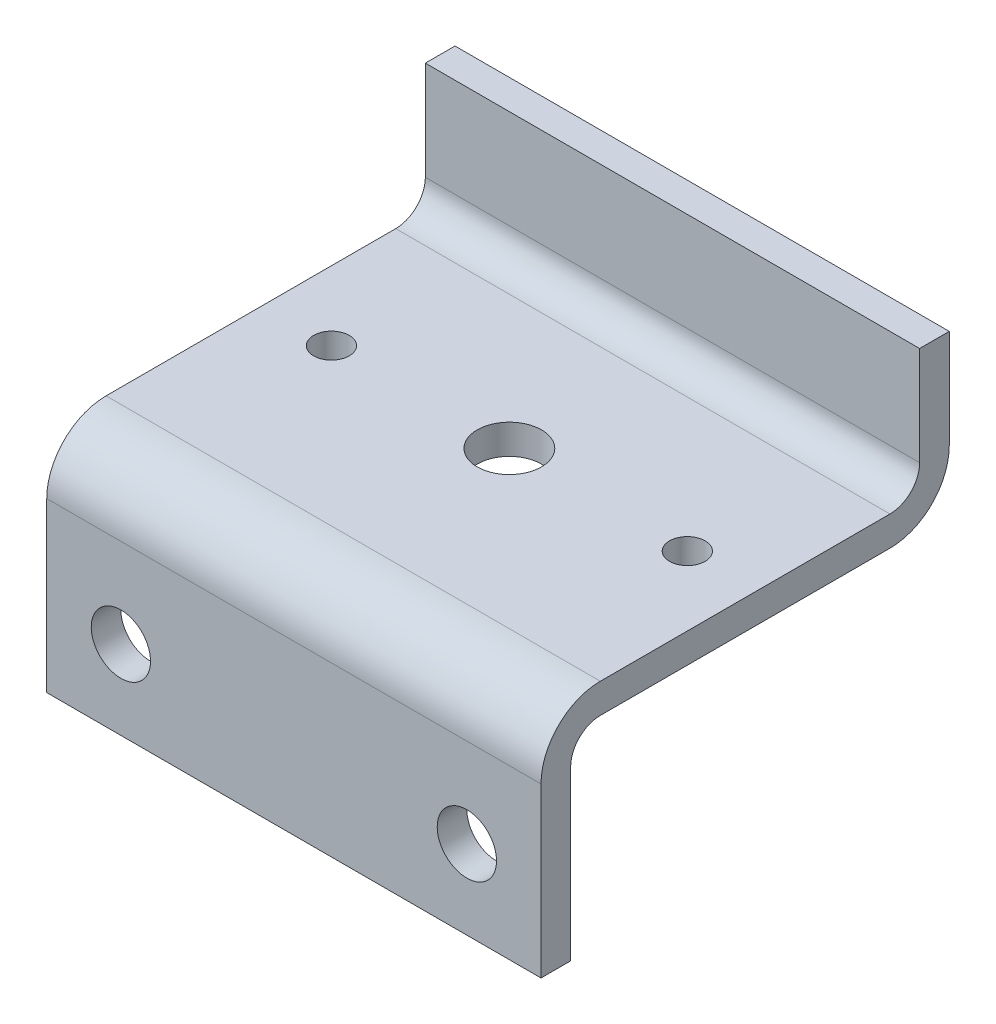
from build123d import *

# Parameters (mm, degrees)
BOSS_EXTRUDE1_DEPTH = 25
CUT_EXTRUDE1_REACH  = 55.476
SKETCH2_R           = 3.25
SKETCH2_R_2         = 1.8
CUT_EXTRUDE2_REACH  = 60.206
SKETCH3_R           = 3


with BuildPart() as part:
    # Sketch1 → Boss-Extrude1 (new, symmetric)
    with BuildSketch(Plane(origin=(0, 0, 0), x_dir=(0, 0, -1), z_dir=(1, 0, 0))):
        with BuildLine():
            Line((0, 0), (0, 17))
            ThreePointArc((0, 17), (1.757359313, 21.242640687), (6, 23))
            Line((6, 23), (35.3, 23))
            ThreePointArc((35.3, 23), (37.421320344, 23.878679656), (38.3, 26))
            Line((38.3, 26), (38.3, 36))
            Line((38.3, 36), (41.3, 36))
            Line((41.3, 36), (41.3, 26))
            ThreePointArc((41.3, 26), (39.542640687, 21.757359313), (35.3, 20))
            Line((35.3, 20), (6, 20))
            ThreePointArc((6, 20), (3.878679656, 19.121320344), (3, 17))
            Line((3, 17), (3, 0))
            Line((3, 0), (0, 0))
        make_face()
    extrude(amount=BOSS_EXTRUDE1_DEPTH, both=True)

    # Sketch2 → Cut-Extrude1 (cut, up to next)
    with BuildSketch(Plane(origin=(0, 23, 0), x_dir=(1, 0, 0), z_dir=(0, 1, 0)), mode=Mode.PRIVATE) as cut_extrude1_sk1:
        with Locations(Location((0, 21.8, 0), (0, 0, 270))):
            Circle(SKETCH2_R)
    cut_extrude1_tool1 = extrude(cut_extrude1_sk1.sketch, amount=-CUT_EXTRUDE1_REACH, mode=Mode.PRIVATE) & part.part
    # Sketch2 → Cut-Extrude1 (cut, up to next)
    with BuildSketch(Plane(origin=(0, 23, 0), x_dir=(1, 0, 0), z_dir=(0, 1, 0)), mode=Mode.PRIVATE) as cut_extrude1_sk2:
        with Locations(Location((-18, 21.8, 0), (0, 0, 270))):
            Circle(SKETCH2_R_2)
    cut_extrude1_tool2 = extrude(cut_extrude1_sk2.sketch, amount=-CUT_EXTRUDE1_REACH, mode=Mode.PRIVATE) & part.part
    # Sketch2 → Cut-Extrude1 (cut, up to next)
    with BuildSketch(Plane(origin=(0, 23, 0), x_dir=(1, 0, 0), z_dir=(0, 1, 0)), mode=Mode.PRIVATE) as cut_extrude1_sk3:
        with Locations(Location((18, 21.8, 0), (0, 0, 270))):
            Circle(SKETCH2_R_2)
    cut_extrude1_tool3 = extrude(cut_extrude1_sk3.sketch, amount=-CUT_EXTRUDE1_REACH, mode=Mode.PRIVATE) & part.part
    add(cut_extrude1_tool1.solids().sort_by_distance((0, 23, -21.8))[0], mode=Mode.SUBTRACT)
    add(cut_extrude1_tool2.solids().sort_by_distance((-18, 23, -21.8))[0], mode=Mode.SUBTRACT)
    add(cut_extrude1_tool3.solids().sort_by_distance((18, 23, -21.8))[0], mode=Mode.SUBTRACT)

    # Sketch3 → Cut-Extrude2 (cut, up to next)
    with BuildSketch(Plane(origin=(0, 0, -3), x_dir=(-1, 0, 0), z_dir=(0, 0, -1)), mode=Mode.PRIVATE) as cut_extrude2_sk1:
        with Locations(Location((-17.5, 8, 0), (0, 0, 90))):
            Circle(SKETCH3_R)
    cut_extrude2_tool1 = extrude(cut_extrude2_sk1.sketch, amount=-CUT_EXTRUDE2_REACH, mode=Mode.PRIVATE) & part.part
    # Sketch3 → Cut-Extrude2 (cut, up to next)
    with BuildSketch(Plane(origin=(0, 0, -3), x_dir=(-1, 0, 0), z_dir=(0, 0, -1)), mode=Mode.PRIVATE) as cut_extrude2_sk2:
        with Locations(Location((17.5, 8, 0), (0, 0, 90))):
            Circle(SKETCH3_R)
    cut_extrude2_tool2 = extrude(cut_extrude2_sk2.sketch, amount=-CUT_EXTRUDE2_REACH, mode=Mode.PRIVATE) & part.part
    add(cut_extrude2_tool1.solids().sort_by_distance((17.5, 8, -3))[0], mode=Mode.SUBTRACT)
    add(cut_extrude2_tool2.solids().sort_by_distance((-17.5, 8, -3))[0], mode=Mode.SUBTRACT)


solid = part.part
